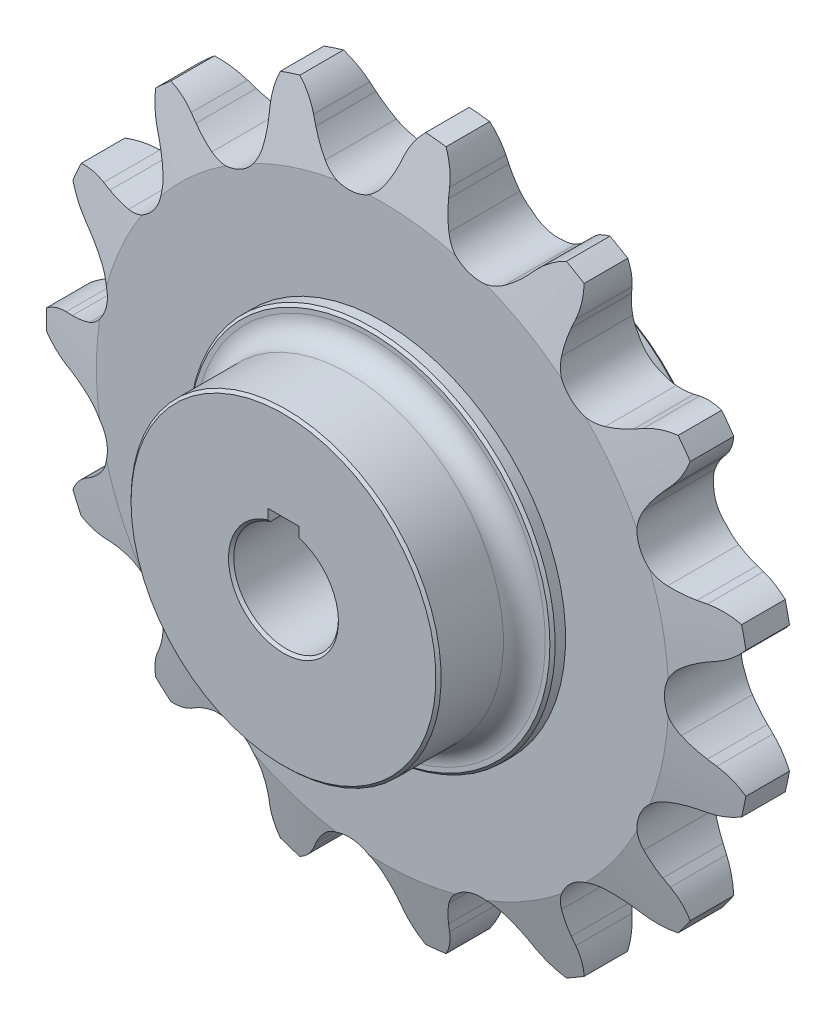
from build123d import *

# Parameters (mm, degrees)
TOOTHCUTSPROCKET01_DEPTH = 14.68119978
TOOTH_PATTERN_15_COUNT   = 15
BOREREVOLVESKETCH_W      = 29.36239956
BOREREVOLVESKETCH_H      = 6.349999905
FILLET1_R                = 8
CUT_EXTRUDE1_DEPTH       = 202.787599017
CUT_EXTRUDE1_DEPTH_BACK  = 202.787599017
SKETCH2_R                = 20
SKETCH2_R_2              = 6.349999905
CHAMFER1_SIZE            = 1


with BuildPart() as part:
    # SketchRevolveSprocket01 → ANSI_160__ISO_32A_Chain (revolve)
    with BuildSketch(Plane(origin=(0, 0, 0), x_dir=(0, 0, -1), z_dir=(1, 0, 0)), mode=Mode.PRIVATE) as ansi_160_iso_32a_chain_sk:
        Polygon((-14.681200027, 0), (-14.681200027, 109.337603139), (-8.331200123, 134.737602757), (8.331199627, 134.737602757), (14.681199532, 109.337603139), (14.681199532, 0), align=None)
    revolve(ansi_160_iso_32a_chain_sk.sketch.rotate(Axis((0, 0, 0), (0, 0, -1)), 90), axis=Axis((0, 0, 0), (0, 0, -1)))

    # SketchToothSprocket01 → ToothCutSprocket01 (cut, symmetric)
    with BuildSketch(Plane.XY):
        with BuildLine():
            Line((123.872691935, 17.372693627), (120.96533592, 16.073703211))
            ThreePointArc((120.96533592, 16.073703211), (116.883872905, 13.876061803), (113.106901388, 11.188599382))
            ThreePointArc((113.106901388, 11.188599382), (107.770213238, 0), (113.106901388, -11.188599382))
            ThreePointArc((113.106901388, -11.188599382), (116.883872905, -13.876061803), (120.96533592, -16.073703211))
            Line((120.96533592, -16.073703211), (123.87248638, -17.372598939))
            ThreePointArc((123.87248638, -17.372598939), (128.87524015, -20.473117879), (132.971010376, -24.699869497))
            ThreePointArc((132.971010376, -24.699869497), (135.853192254, 0), (132.971010376, 24.699869497))
            ThreePointArc((132.971010376, 24.699869497), (128.875328282, 20.473188854), (123.872691935, 17.372693627))
        make_face()
    toothcutsprocket01 = extrude(amount=TOOTHCUTSPROCKET01_DEPTH, both=True, mode=Mode.SUBTRACT)

    # Tooth Pattern, 15: ToothCutSprocket01 ×15 about axis
    tooth_pattern_15_axis = Axis((0, 0, 0), (0, 0, 1))
    for i in range(1, TOOTH_PATTERN_15_COUNT):
        add(toothcutsprocket01.rotate(tooth_pattern_15_axis, i * 360 / TOOTH_PATTERN_15_COUNT), mode=Mode.SUBTRACT)

    # BoreRevolveSketch → BoreRevolveCut (revolve, cut)
    with BuildSketch(Plane(origin=(0, 0, 0), x_dir=(0, 0, -1), z_dir=(1, 0, 0)), mode=Mode.PRIVATE) as borerevolvecut_sk:
        with Locations((0, 3.174999953)):
            Rectangle(BOREREVOLVESKETCH_W, BOREREVOLVESKETCH_H)
    revolve(borerevolvecut_sk.sketch.rotate(Axis((0, 0, 0), (0, 0, -1)), 90), axis=Axis((0, 0, 0), (0, 0, -1)), mode=Mode.SUBTRACT)

    # Sketch1 → Revolve1 (revolve)
    with BuildSketch(Plane(origin=(0, 0, 0), x_dir=(1, 0, 0), z_dir=(0, 1, 0)), mode=Mode.PRIVATE) as revolve1_sk:
        Polygon((20, -52.5), (20, 52.5), (59.25, 52.5), (59.25, 19.681199532), (70, 19.681199532), (70, 14.681199532), (70, -14.681199532), (70, -19.681199532), (59.25, -19.681199532), (59.25, -52.5), align=None)
    revolve(revolve1_sk.sketch.rotate(Axis((0, 0, -52.5), (0, 0, 1)), 180), axis=Axis((0, 0, -52.5), (0, 0, 1)))

    # Fillet1
    fillet1_edges = [part.edges().sort_by_distance(p)[0] for p in [
        (59.25, 0, -19.681199532),
        (59.25, 0, 19.681199532),
    ]]
    fillet(fillet1_edges, radius=FILLET1_R)

    # Sketch2 → Cut-Extrude1 (cut, two sides: drawn at the far end of the back side and taken through both)
    # profile 1 of 2: a face of its own
    with BuildSketch(Plane(origin=(0, 0, -14.681199532), x_dir=(-1, 0, 0), z_dir=(0, 0, -1)).offset(-CUT_EXTRUDE1_DEPTH_BACK)):
        with BuildLine():
            ThreePointArc((-6, 19.078784028), (0, 20), (6, 19.078784028))
            Line((6, 19.078784028), (6, 24))
            Line((6, 24), (-6, 24))
            Line((-6, 24), (-6, 19.078784028))
        make_face()
    # profile 2 of 2: a face of its own
    with BuildSketch(Plane(origin=(0, 0, -14.681199532), x_dir=(-1, 0, 0), z_dir=(0, 0, -1)).offset(-CUT_EXTRUDE1_DEPTH_BACK)):
        Circle(SKETCH2_R)
        Circle(SKETCH2_R_2, mode=Mode.SUBTRACT)
    extrude(amount=CUT_EXTRUDE1_DEPTH + CUT_EXTRUDE1_DEPTH_BACK, mode=Mode.SUBTRACT)

    # Chamfer1
    chamfer1_edges = [part.edges().sort_by_distance(p)[0] for p in [
        (70, 0, 19.681199532),
        (59.25, 0, -52.5),
        (70, 0, -19.681199532),
        (59.25, 0, 52.5),
        (0, -20, 52.5),
        (0, -20, -52.5),
    ]]
    chamfer(chamfer1_edges, length=CHAMFER1_SIZE)


solid = part.part
